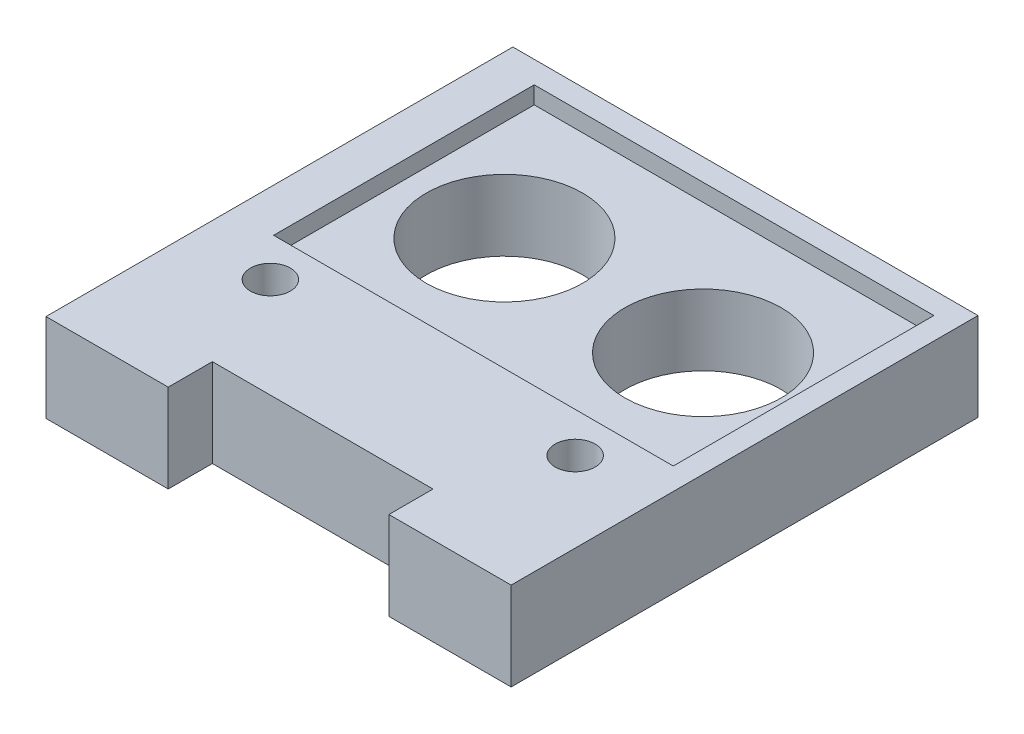
from build123d import *

# Parameters (mm, degrees)
SKETCH1_R           = 4.5
SKETCH1_R_2         = 1.15
BOSS_EXTRUDE1_DEPTH = 5.08
SKETCH4_W           = 23
SKETCH4_H           = 15
CUT_EXTRUDE1_DEPTH  = 1


with BuildPart() as part:
    # Sketch1 → Boss-Extrude1 (new body)
    with BuildSketch(Plane(origin=(0, 0, 0), x_dir=(1, 0, 0), z_dir=(0, 1, 0))):
        Polygon((-14, 8.77), (12.77, 8.77), (12.77, -18.1), (5.735, -18.1), (5.735, -15.56), (-6.965, -15.56), (-6.965, -18.1), (-14, -18.1), align=None)
        with Locations(Location((-5.715, 0, 0), (0, 0, 270))):
            Circle(SKETCH1_R, mode=Mode.SUBTRACT)
        with Locations(Location((5.715, 0, 0), (0, 0, 270))):
            Circle(SKETCH1_R, mode=Mode.SUBTRACT)
        with Locations(Location((-9.384999986, -9.8, 0), (0, 0, 270))):
            Circle(SKETCH1_R_2, mode=Mode.SUBTRACT)
        with Locations(Location((8.154999986, -9.8, 0), (0, 0, 270))):
            Circle(SKETCH1_R_2, mode=Mode.SUBTRACT)
    extrude(amount=BOSS_EXTRUDE1_DEPTH)

    # Sketch4 → Cut-Extrude1 (cut)
    with BuildSketch(Plane(origin=(0, 5.08, 0), x_dir=(1, 0, 0), z_dir=(0, 1, 0))):
        Rectangle(SKETCH4_W, SKETCH4_H)
    extrude(amount=-CUT_EXTRUDE1_DEPTH, mode=Mode.SUBTRACT)


solid = part.part
